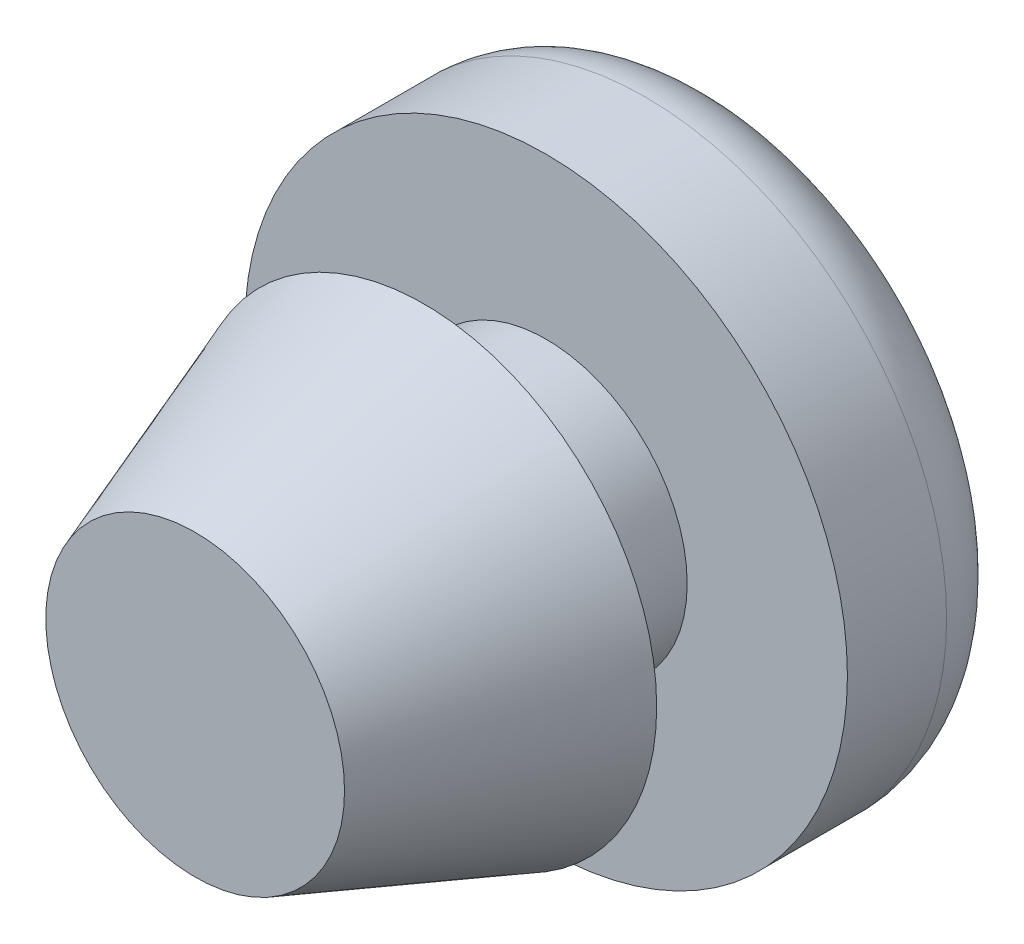
from build123d import *

# Parameters (mm, degrees)
SKETCH_1_R      = 3.95
EXTRUDE_1_DEPTH = 2.3
SKETCH_2_R      = 1.85
EXTRUDE_2_DEPTH = 1.6
SKETCH_3_R      = 3.05
EXTRUDE_3_DEPTH = 3
DRAFT_7_ANGLE   = -20
FILLET_1_R      = 1


with BuildPart() as part:
    # 草图1 → 凸台-拉伸1 (new body)
    with BuildSketch(Plane.XY):
        Circle(SKETCH_1_R)
    extrude(amount=EXTRUDE_1_DEPTH)

    # 草图2 → 凸台-拉伸2 (add)
    with BuildSketch(Plane.XY.offset(2.3)):
        Circle(SKETCH_2_R)
    extrude(amount=EXTRUDE_2_DEPTH)

    # 草图3 → 凸台-拉伸3 (add)
    with BuildSketch(Plane.XY.offset(3.9)):
        Circle(SKETCH_3_R)
    extrude(amount=EXTRUDE_3_DEPTH)

    # 拔模7
    draft_7_faces = [part.faces().sort_by_distance(p)[0] for p in [
        (-3.05, 0, 5.4),
    ]]
    draft(draft_7_faces, Plane(origin=(0, 0, 3.9), x_dir=(-1, 0, 0), z_dir=(0, 0, -1)), DRAFT_7_ANGLE)

    # 圆角1
    fillet_1_edges = [part.edges().sort_by_distance(p)[0] for p in [
        (-3.95, 0, 0),
    ]]
    fillet(fillet_1_edges, radius=FILLET_1_R)


solid = part.part
